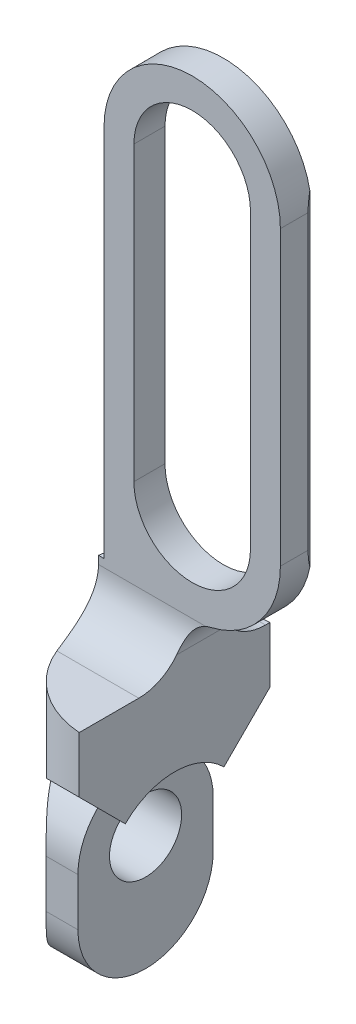
from build123d import *

# Parameters (mm, degrees)
BOSS_EXTRUDE1_START = -8
SKETCH1_R           = 4
BOSS_EXTRUDE1_DEPTH = 38.1
SKETCH2_OUTSIDE_W   = 17.948
SKETCH2_OUTSIDE_H   = 48.048
CUT_EXTRUDE1_DEPTH  = 5
CUT_EXTRUDE2_DEPTH  = 30.290925305
SKETCH4_R           = 1.508332
CUT_EXTRUDE3_DEPTH  = 29.54645306
CUT_EXTRUDE4_DEPTH  = 1.216665


with BuildPart() as part:
    # Sketch1 → Boss-Extrude1 (new body)
    with BuildSketch(Plane(origin=(0, 0, 0), x_dir=(1, 0, 0), z_dir=(0, 1, 0)).offset(BOSS_EXTRUDE1_START)):
        with Locations(Location((0, 0, 0), (0, 0, 90))):
            Circle(SKETCH1_R)
    extrude(amount=BOSS_EXTRUDE1_DEPTH)

    # Sketch2 outside → Cut-Extrude1 (cut, symmetric)
    # profile 1 of 2: a face of its own
    with BuildSketch(Plane.XY):
        with Locations((0, 11.05)):
            Rectangle(SKETCH2_OUTSIDE_W, SKETCH2_OUTSIDE_H)
        with BuildLine():
            Line((-0.283333, -8), (-0.283333, 7.109115))
            ThreePointArc((-0.283333, 7.109115), (0.003787455, 7.935683585), (0.741491463, 8.406264691))
            ThreePointArc((0.741491463, 8.406264691), (2.828033272, 9.737268918), (3.64013247, 12.075157679))
            Line((3.64013247, 12.075157679), (3.64013247, 24.303947679))
            ThreePointArc((3.64013247, 24.303947679), (-0.04853801, 27.99261816), (-3.73720849, 24.303947679))
            Line((-3.73720849, 24.303947679), (-3.73720849, 8.666658))
            Line((-3.73720849, 8.666658), (-4, 8.666658))
            Line((-4, 8.666658), (-4, -8))
            Line((-4, -8), (-0.283333, -8))
        make_face(mode=Mode.SUBTRACT)
    # profile 2 of 2: a face of its own
    with BuildSketch(Plane.XY):
        with BuildLine():
            Line((2.38936199, 24.303947679), (2.38936199, 12.075157679))
            ThreePointArc((2.38936199, 12.075157679), (-0.04853801, 9.637257679), (-2.48643801, 12.075157679))
            Line((-2.48643801, 12.075157679), (-2.48643801, 24.303947679))
            ThreePointArc((-2.48643801, 24.303947679), (-0.04853801, 26.741847679), (2.38936199, 24.303947679))
        make_face()
    extrude(amount=CUT_EXTRUDE1_DEPTH, both=True, mode=Mode.SUBTRACT)

    # Sketch3 → Cut-Extrude2 (cut, through all)
    with BuildSketch(Plane(origin=(3.64013247, 0, 0), x_dir=(0, 0, -1), z_dir=(1, 0, 0))):
        with BuildLine():
            Line((-1.5, 6.333332), (-6.5, 6.333332))
            Line((-6.5, 6.333332), (-6.5, 36.333332))
            Line((-6.5, 36.333332), (0.5, 36.333332))
            Line((0.5, 36.333332), (0.5, 8.333332))
            ThreePointArc((0.5, 8.333332), (-0.085786438, 6.919118438), (-1.5, 6.333332))
        make_face()
        with BuildLine():
            Line((1.8, 36.333332), (1.8, 8.333332))
            ThreePointArc((1.8, 8.333332), (2.385786438, 6.919118438), (3.8, 6.333332))
            Line((3.8, 6.333332), (5.8, 6.333332))
            Line((5.8, 6.333332), (5.8, 36.333332))
            Line((5.8, 36.333332), (1.8, 36.333332))
        make_face()
    extrude(amount=-CUT_EXTRUDE2_DEPTH, mode=Mode.SUBTRACT)

    # Sketch4 → Cut-Extrude3 (cut, through all)
    with BuildSketch(Plane(origin=(-0.283333, 0, 0), x_dir=(0, 0, -1), z_dir=(1, 0, 0))):
        with Locations(Location((0, 0, 0), (0, 0, 90))):
            Circle(SKETCH4_R)
        with BuildLine():
            Line((-2.828427125, 0), (-2.828427125, -2))
            ThreePointArc((-2.828427125, -2), (0, -4.828427125), (2.828427125, -2))
            Line((2.828427125, -2), (2.828427125, 0))
            ThreePointArc((2.828427125, 0), (2.61312593, 1.0823922), (2, 2))
            Line((2, 2), (3.989952683, 3.989952683))
            Line((3.989952683, 3.989952683), (5, 3.989952683))
            Line((5, 3.989952683), (5, -11.010047317))
            Line((5, -11.010047317), (-5, -11.010047317))
            Line((-5, -11.010047317), (-5, 3.989952683))
            Line((-5, 3.989952683), (-3.989952683, 3.989952683))
            Line((-3.989952683, 3.989952683), (-2, 2))
            ThreePointArc((-2, 2), (-2.61312593, 1.0823922), (-2.828427125, 0))
        make_face()
    extrude(amount=-CUT_EXTRUDE3_DEPTH, mode=Mode.SUBTRACT)

    # Sketch5 → Cut-Extrude4 (cut)
    with BuildSketch(Plane(origin=(-0.283333, 0, 0), x_dir=(0, 0, -1), z_dir=(1, 0, 0))):
        with BuildLine():
            Line((-2.916664, 0), (-2.916664, -2.54))
            ThreePointArc((-2.916664, -2.54), (0, -5.456664), (2.916664, -2.54))
            Line((2.916664, -2.54), (2.916664, 0))
            ThreePointArc((2.916664, 0), (0, 2.916664), (-2.916664, 0))
        make_face()
    extrude(amount=-CUT_EXTRUDE4_DEPTH, mode=Mode.SUBTRACT)


solid = part.part
